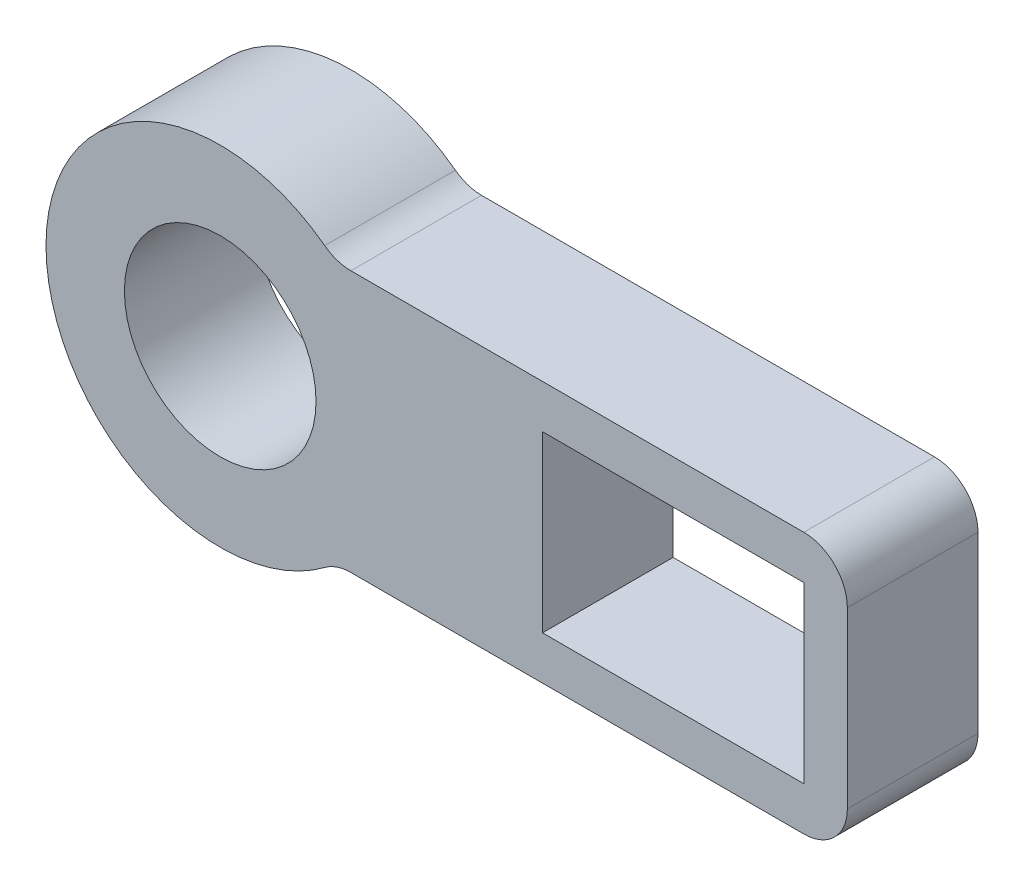
from build123d import *

# Parameters (mm, degrees)
SKETCH1_R           = 2.794
SKETCH1_W           = 7.62
SKETCH1_H           = 5.08
BOSS_EXTRUDE1_DEPTH = 1.905
FILLET1_R           = 1.27


with BuildPart() as part:
    # Sketch1 → Boss-Extrude1 (new, symmetric)
    with BuildSketch(Plane.XY):
        with BuildLine():
            Line((3.360104165, 3.81), (18.288, 3.81))
            Line((18.288, 3.81), (18.288, -3.81))
            Line((18.288, -3.81), (3.360104165, -3.81))
            ThreePointArc((3.360104165, -3.81), (-5.08, 0), (3.360104165, 3.81))
        make_face()
        with Locations(Location((0, 0, 0), (0, 0, 180))):
            Circle(SKETCH1_R, mode=Mode.SUBTRACT)
        with Locations((13.208, 0)):
            Rectangle(SKETCH1_W, SKETCH1_H, mode=Mode.SUBTRACT)
    extrude(amount=BOSS_EXTRUDE1_DEPTH, both=True)

    # Fillet1
    fillet1_edges = [part.edges().sort_by_distance(p)[0] for p in [
        (3.360104165, 3.81, 0),
        (18.288, 3.81, 0),
        (18.288, -3.81, 0),
        (3.360104165, -3.81, 0),
    ]]
    fillet(fillet1_edges, radius=FILLET1_R)


solid = part.part
